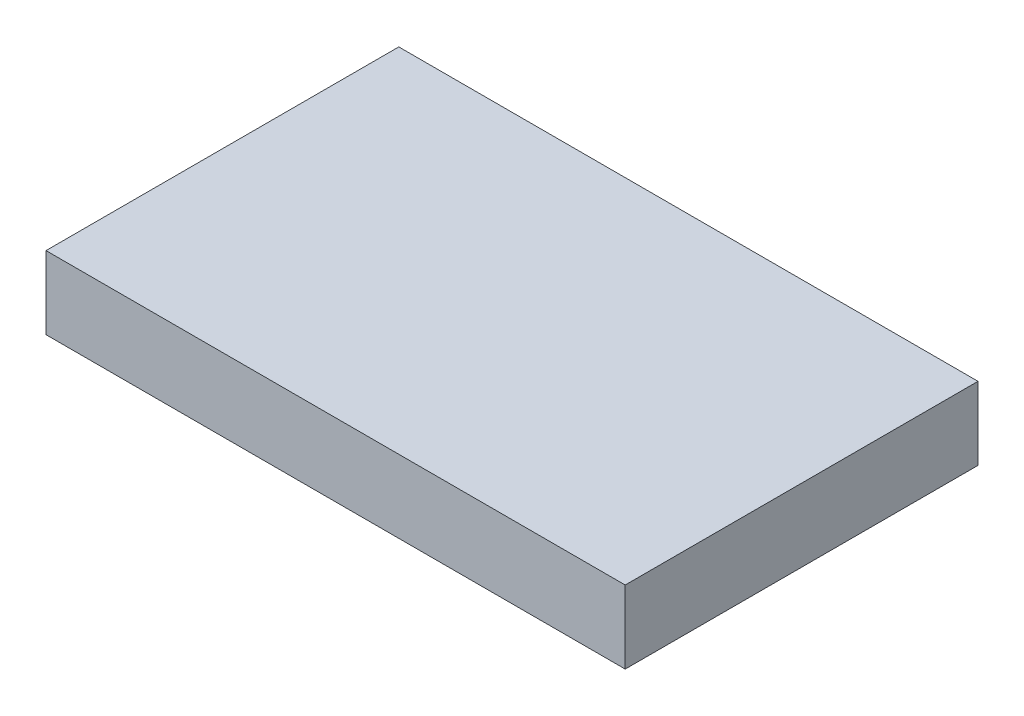
from build123d import *

# Parameters (mm, degrees)
SKETCH_1_W      = 33
SKETCH_1_H      = 20.1
EXTRUDE_1_DEPTH = 4.15


with BuildPart() as part:
    # 草图1 → 凸台-拉伸1 (new body)
    with BuildSketch(Plane(origin=(0, 0, 0), x_dir=(1, 0, 0), z_dir=(0, 1, 0))):
        with Locations((7.171568627, -5.951960784)):
            Rectangle(SKETCH_1_W, SKETCH_1_H)
    extrude(amount=EXTRUDE_1_DEPTH)


solid = part.part
